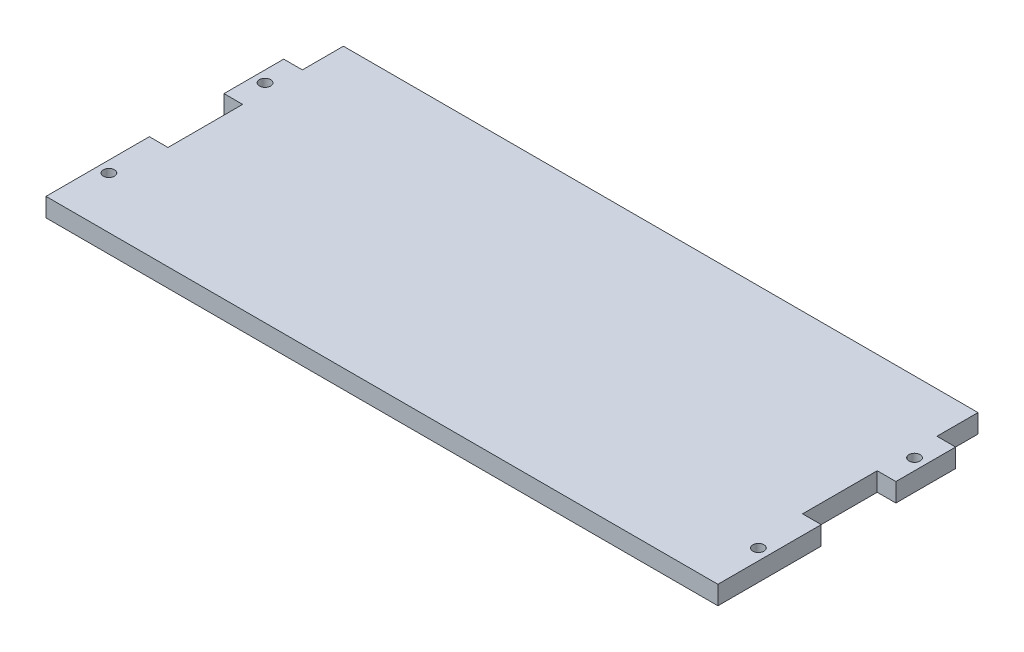
from build123d import *

# Parameters (mm, degrees)
CROQUIS1_W              = 170
CROQUIS1_H              = 20
CROQUIS1_W_2            = 180
CROQUIS1_H_2            = 16
SALIENTE_EXTRUIR1_DEPTH = 5
CROQUIS2_R              = 1.5
CORTAR_EXTRUIR1_DEPTH   = 106.949338837
CROQUIS3_W              = 170
CROQUIS3_H              = 15
SALIENTE_EXTRUIR2_DEPTH = 5
CROQUIS5_W              = 170
CROQUIS5_H              = 4
CORTAR_EXTRUIR3_DEPTH   = 106.949338837


with BuildPart() as part:
    # Croquis1 → Saliente-Extruir1 (new body)
    with BuildSketch(Plane(origin=(0, 0, 0), x_dir=(1, 0, 0), z_dir=(0, 1, 0))):
        Polygon((90, -28), (85, -28), (-85, -28), (-90, -28), (-90, -55.68), (90, -55.68), align=None)
        with Locations((0, -18)):
            Rectangle(CROQUIS1_W, CROQUIS1_H)
        Rectangle(CROQUIS1_W_2, CROQUIS1_H_2)
    extrude(amount=SALIENTE_EXTRUIR1_DEPTH)

    # Croquis2 → Cortar-Extruir1 (cut, through all)
    with BuildSketch(Plane(origin=(0, 5, 0), x_dir=(1, 0, 0), z_dir=(0, 1, 0))):
        with Locations(Location((-87, 0, 0), (0, 0, 270))):
            Circle(CROQUIS2_R)
        with Locations(Location((-87, -41.84, 0), (0, 0, 270))):
            Circle(CROQUIS2_R)
    cortar_extruir1 = extrude(amount=-CORTAR_EXTRUIR1_DEPTH, mode=Mode.SUBTRACT)

    # Simetría1: Cortar-Extruir1 across plane
    add(cortar_extruir1.mirror(Plane(origin=(0, 0, 0), x_dir=(0, 0, 1), z_dir=(1, 0, 0))), mode=Mode.SUBTRACT)

    # Croquis3 → Saliente-Extruir2 (add)
    with BuildSketch(Plane(origin=(0, 5, 0), x_dir=(1, 0, 0), z_dir=(0, 1, 0))):
        with Locations((0, 15.5)):
            Rectangle(CROQUIS3_W, CROQUIS3_H)
    extrude(amount=-SALIENTE_EXTRUIR2_DEPTH)

    # Croquis5 → Cortar-Extruir3 (cut, through all)
    with BuildSketch(Plane(origin=(0, 5, 0), x_dir=(1, 0, 0), z_dir=(0, 1, 0))):
        with Locations((0, 21)):
            Rectangle(CROQUIS5_W, CROQUIS5_H)
    extrude(amount=-CORTAR_EXTRUIR3_DEPTH, mode=Mode.SUBTRACT)


solid = part.part
